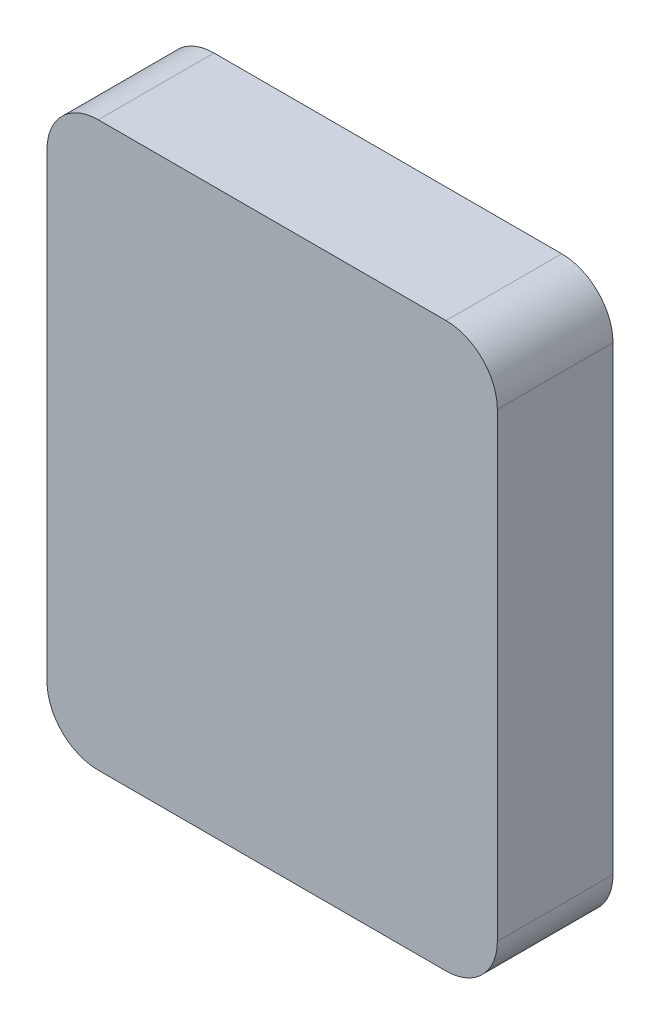
from build123d import *

# Parameters (mm, degrees)
BOSS_EXTRUDE1_DEPTH = 15.7856


with BuildPart() as part:
    # Sketch1 → Boss-Extrude1 (new body)
    with BuildSketch(Plane.XY):
        with BuildLine():
            Line((-24.474767558, 46.647032967), (-24.474767558, -16.232967033))
            ThreePointArc((-24.474767558, -16.232967033), (-22.424515026, -21.182714501), (-17.474767558, -23.232967033))
            Line((-17.474767558, -23.232967033), (29.985232442, -23.232967033))
            ThreePointArc((29.985232442, -23.232967033), (34.93497991, -21.182714501), (36.985232442, -16.232967033))
            Line((36.985232442, -16.232967033), (36.985232442, 46.647032967))
            ThreePointArc((36.985232442, 46.647032967), (34.93497991, 51.596780435), (29.985232442, 53.647032967))
            Line((29.985232442, 53.647032967), (-17.474767558, 53.647032967))
            ThreePointArc((-17.474767558, 53.647032967), (-22.424515026, 51.596780435), (-24.474767558, 46.647032967))
        make_face()
    extrude(amount=BOSS_EXTRUDE1_DEPTH)


solid = part.part
